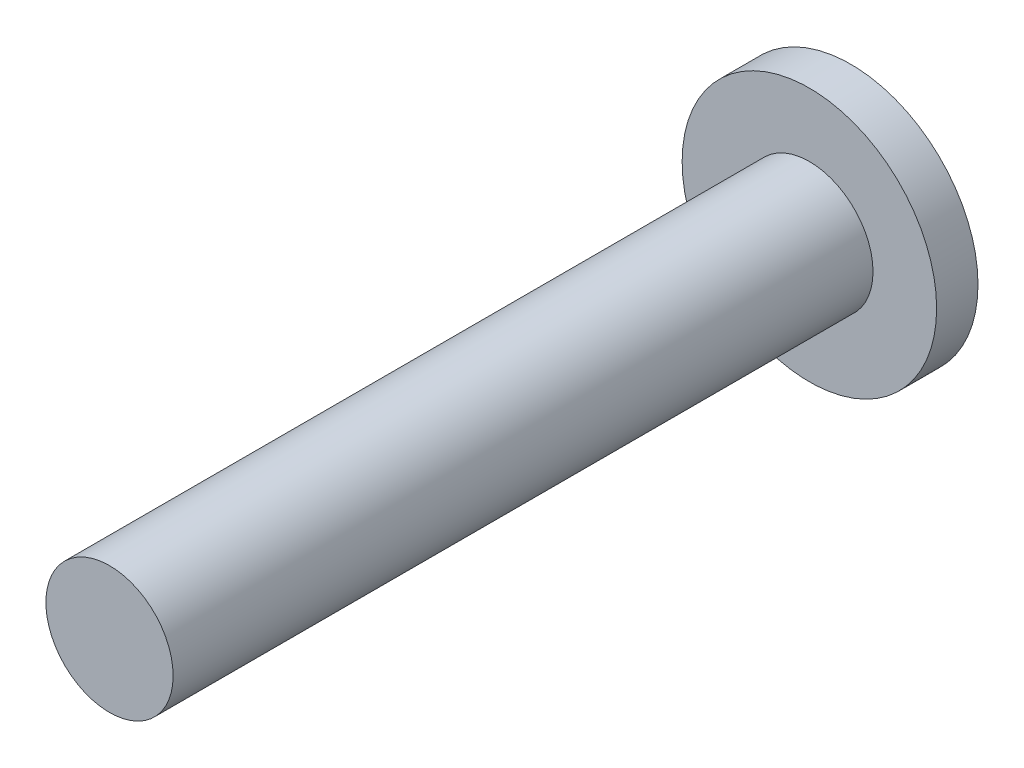
from build123d import *

# Parameters (mm, degrees)
SKETCH_1_R          = 4
EXTRUDE_1_DEPTH     = 1.3
SKETCH_2_R          = 2
EXTRUDE_2_DEPTH     = 22
CUT_EXTRUDE_1_DEPTH = 1


with BuildPart() as part:
    # 草图1 → 凸台-拉伸1 (new body)
    with BuildSketch(Plane.XY):
        Circle(SKETCH_1_R)
    extrude(amount=EXTRUDE_1_DEPTH)

    # 草图2 → 凸台-拉伸2 (add)
    with BuildSketch(Plane.XY.offset(1.3)):
        Circle(SKETCH_2_R)
    extrude(amount=EXTRUDE_2_DEPTH)

    # 草图3 → 切除-拉伸1 (cut)
    with BuildSketch(Plane(origin=(0, 0, 0), x_dir=(-1, 0, 0), z_dir=(0, 0, -1))):
        Polygon((1.443375673, 0), (0.721687836, 1.25), (-0.721687836, 1.25), (-1.443375673, 0), (-0.721687836, -1.25), (0.721687836, -1.25), align=None)
    extrude(amount=-CUT_EXTRUDE_1_DEPTH, mode=Mode.SUBTRACT)


solid = part.part
